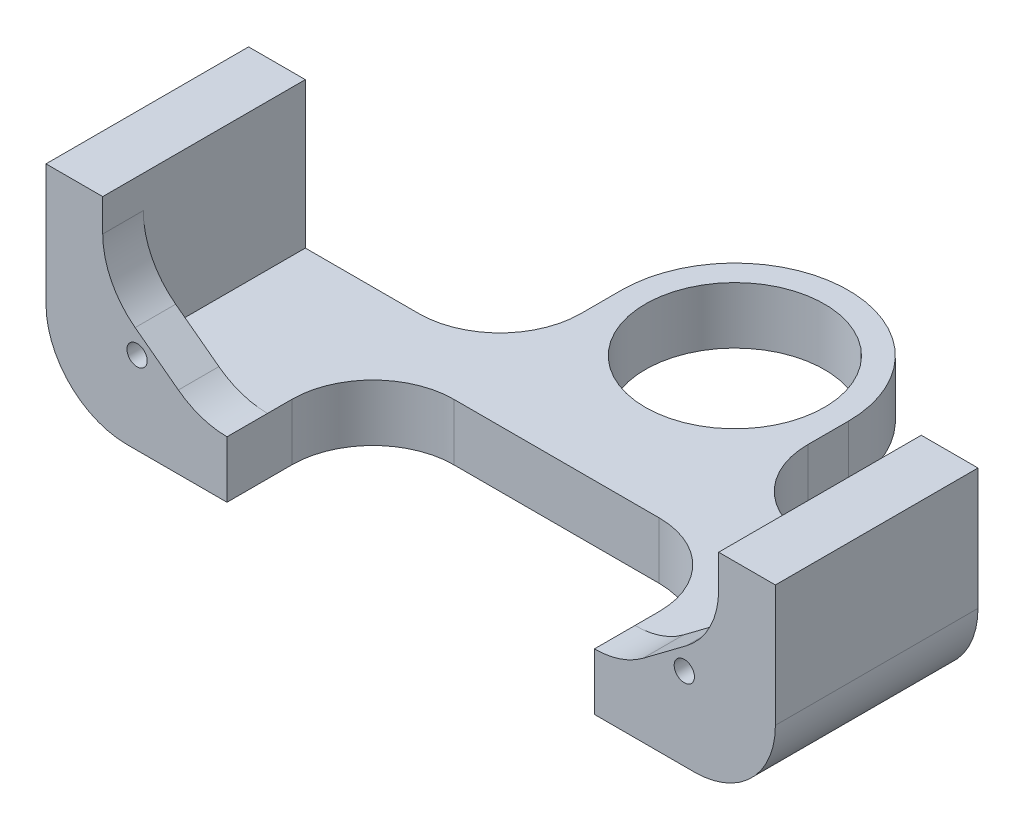
from build123d import *

# Parameters (mm, degrees)
SKETCH1_R           = 11.05
BOSS_EXTRUDE1_DEPTH = 7
SKETCH2_R           = 1.25
BOSS_EXTRUDE2_DEPTH = 5
BOSS_EXTRUDE3_DEPTH = 20
FILLET1_R           = 10
SKETCH5_W           = 45.333333334
SKETCH5_H           = 18
CUT_EXTRUDE2_DEPTH  = 7
FILLET2_R           = 10


with BuildPart() as part:
    # Sketch1 → Boss-Extrude1 (new body)
    with BuildSketch(Plane(origin=(0, 0, 0), x_dir=(1, 0, 0), z_dir=(0, 1, 0))):
        with BuildLine():
            Line((0, 0), (0, -40))
            Line((0, -40), (28, -40))
            Line((28, -40), (28, 0))
            ThreePointArc((28, 0), (14, 14), (0, 0))
        make_face()
        with Locations(Location((14, 0, 0), (0, 0, 270))):
            Circle(SKETCH1_R, mode=Mode.SUBTRACT)
    extrude(amount=BOSS_EXTRUDE1_DEPTH)

    # Sketch2 → Boss-Extrude2 (add)
    with BuildSketch(Plane.XY.offset(40)):
        Polygon((52, 16), (52, 25), (59, 25), (59, 0), (28, 0), (28, 7), (40, 7), align=None)
        with Locations((47.76, 10.18)):
            Circle(SKETCH2_R, mode=Mode.SUBTRACT)
    boss_extrude2 = extrude(amount=-BOSS_EXTRUDE2_DEPTH)

    # Sketch3 → Boss-Extrude3 (add)
    with BuildSketch(Plane(origin=(0, 0, 35), x_dir=(-1, 0, 0), z_dir=(0, 0, -1))):
        Polygon((-52, 16), (-52, 7), (-40, 7), (-28, 7), (-28, 0), (-59, 0), (-59, 25), (-52, 25), align=None)
    boss_extrude3 = extrude(amount=BOSS_EXTRUDE3_DEPTH)

    # Mirror1: Boss-Extrude2, Boss-Extrude3 across plane
    add(boss_extrude2.mirror(Plane(origin=(14, 0, 0), x_dir=(0, 0, 1), z_dir=(1, 0, 0))))
    add(boss_extrude3.mirror(Plane(origin=(14, 0, 0), x_dir=(0, 0, 1), z_dir=(1, 0, 0))))

    # Fillet1
    fillet1_edges = [part.edges().sort_by_distance(p)[0] for p in [
        (52, 16, 37.5),
        (59, 0, 27.5),
        (40, 7, 37.5),
        (28, 3.5, 15),
        (-24, 16, 37.5),
        (-12, 7, 37.5),
        (-31, 0, 27.5),
        (0, 3.5, 15),
    ]]
    fillet(fillet1_edges, radius=FILLET1_R)

    # Sketch5 → Cut-Extrude2 (cut)
    with BuildSketch(Plane(origin=(0, 7, 0), x_dir=(1, 0, 0), z_dir=(0, 1, 0))):
        with Locations((14, -31)):
            Rectangle(SKETCH5_W, SKETCH5_H)
    extrude(amount=-CUT_EXTRUDE2_DEPTH, mode=Mode.SUBTRACT)

    # Fillet2
    fillet2_edges = [part.edges().sort_by_distance(p)[0] for p in [
        (-8.666666667, 3.5, 22),
        (36.666666667, 3.5, 22),
    ]]
    fillet(fillet2_edges, radius=FILLET2_R)


solid = part.part
